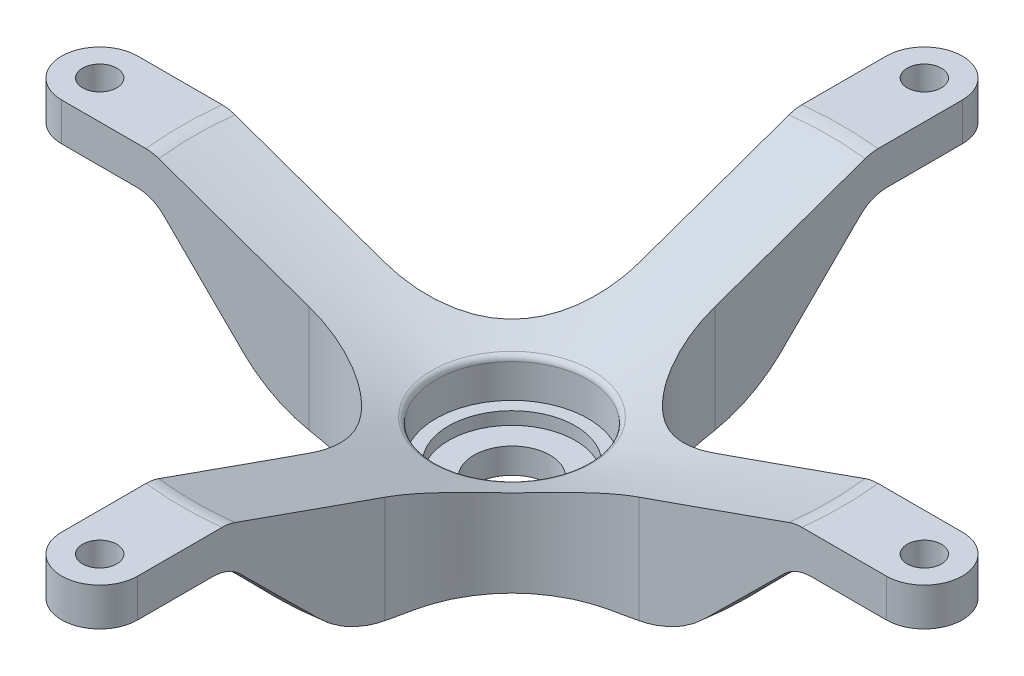
from build123d import *

# Parameters (mm, degrees)
D_GAGEMENT_M2_51_D           = 2.7
R_P_TITION_CIRCULAIRE1_COUNT = 4
ENL_V_MAT_EXTRU_1_DEPTH      = 52.894616773


with BuildPart() as part:
    # Esquisse1 → Révolution1 (revolve)
    with BuildSketch(Plane.XY, mode=Mode.PRIVATE) as r_volution1_sk:
        with BuildLine():
            Line((-11.382864376, 0), (-3, 0))
            Line((-3, 0), (-3, 2))
            Line((-3, 2), (-5, 2))
            Line((-5, 2), (-5, 3))
            Line((-5, 3), (-6, 3))
            Line((-6, 3), (-6, 5.648095238))
            ThreePointArc((-6, 5.648095238), (-6.091117155, 5.935870879), (-6.331259276, 6.118761328))
            Line((-6.331259276, 6.118761328), (-25.034076062, 12.823996539))
            ThreePointArc((-25.034076062, 12.823996539), (-25.532706049, 12.955671634), (-26.046520404, 13))
            Line((-26.046520404, 13), (-35.525, 13))
            Line((-35.525, 13), (-35.525, 10))
            Line((-35.525, 10), (-26.767640687, 10))
            ThreePointArc((-26.767640687, 10), (-25.61959039, 9.771638598), (-24.646320344, 9.121320344))
            Line((-24.646320344, 9.121320344), (-18.453932188, 2.928932188))
            ThreePointArc((-18.453932188, 2.928932188), (-15.2096987, 0.761204675), (-11.382864376, 0))
        make_face()
    revolve(r_volution1_sk.sketch.rotate(Axis((0, 5.07757265, 0), (0, -1, 0)), 270), axis=Axis((0, 5.07757265, 0), (0, -1, 0)))

    # Dégagement M2.51 (through all)
    with Locations(Plane(origin=(0, 13, 0), x_dir=(1, 0, 0), z_dir=(0, 1, 0))):
        with Locations((-32.525, 0)):
            d_gagement_m2_51 = Hole(D_GAGEMENT_M2_51_D / 2)

    # Répétition circulaire1: Dégagement M2.51 ×4 about axis
    r_p_tition_circulaire1_axis = Axis((0, 0, 0), (0, 1, 0))
    for i in range(1, R_P_TITION_CIRCULAIRE1_COUNT):
        add(d_gagement_m2_51.rotate(r_p_tition_circulaire1_axis, i * 360 / R_P_TITION_CIRCULAIRE1_COUNT), mode=Mode.SUBTRACT)

    # Esquisse4 → Enlèv. mat.-Extru.1 (cut, through all)
    with BuildSketch(Plane(origin=(0, 13, 0), x_dir=(1, 0, 0), z_dir=(0, 1, 0))):
        with BuildLine():
            ThreePointArc((3e-09, 35.525), (2.121320345, 34.646320343), (3, 32.525))
            Line((3, 32.525), (3, 13))
            ThreePointArc((3, 13), (5.928932188, 5.928932188), (13, 3))
            Line((13, 3), (32.525, 3))
            ThreePointArc((32.525, 3), (34.646320344, 2.121320344), (35.525, 0))
            ThreePointArc((35.525, 0), (25.119968403, 25.119968401), (3e-09, 35.525))
        make_face()
        with BuildLine():
            ThreePointArc((-3, 32.525), (-2.121320343, 34.646320345), (3e-09, 35.525))
            ThreePointArc((3e-09, 35.525), (-25.119968401, 25.119968403), (-35.525, 0))
            ThreePointArc((-35.525, 0), (-34.646320344, 2.121320344), (-32.525, 3))
            Line((-32.525, 3), (-13, 3))
            ThreePointArc((-13, 3), (-5.928932188, 5.928932188), (-3, 13))
            Line((-3, 13), (-3, 32.525))
        make_face()
        with BuildLine():
            ThreePointArc((0, -35.525), (25.119968402, -25.119968402), (35.525, 0))
            ThreePointArc((35.525, 0), (34.646320344, -2.121320344), (32.525, -3))
            Line((32.525, -3), (13, -3))
            ThreePointArc((13, -3), (5.928932188, -5.928932188), (3, -13))
            Line((3, -13), (3, -32.525))
            ThreePointArc((3, -32.525), (2.121320344, -34.646320344), (0, -35.525))
        make_face()
        with BuildLine():
            ThreePointArc((-32.525, -3), (-34.646320344, -2.121320344), (-35.525, 0))
            ThreePointArc((-35.525, 0), (-25.119968402, -25.119968402), (0, -35.525))
            ThreePointArc((0, -35.525), (-2.121320344, -34.646320344), (-3, -32.525))
            Line((-3, -32.525), (-3, -13))
            ThreePointArc((-3, -13), (-5.928932188, -5.928932188), (-13, -3))
            Line((-13, -3), (-32.525, -3))
        make_face()
    extrude(amount=-ENL_V_MAT_EXTRU_1_DEPTH, mode=Mode.SUBTRACT)


solid = part.part
